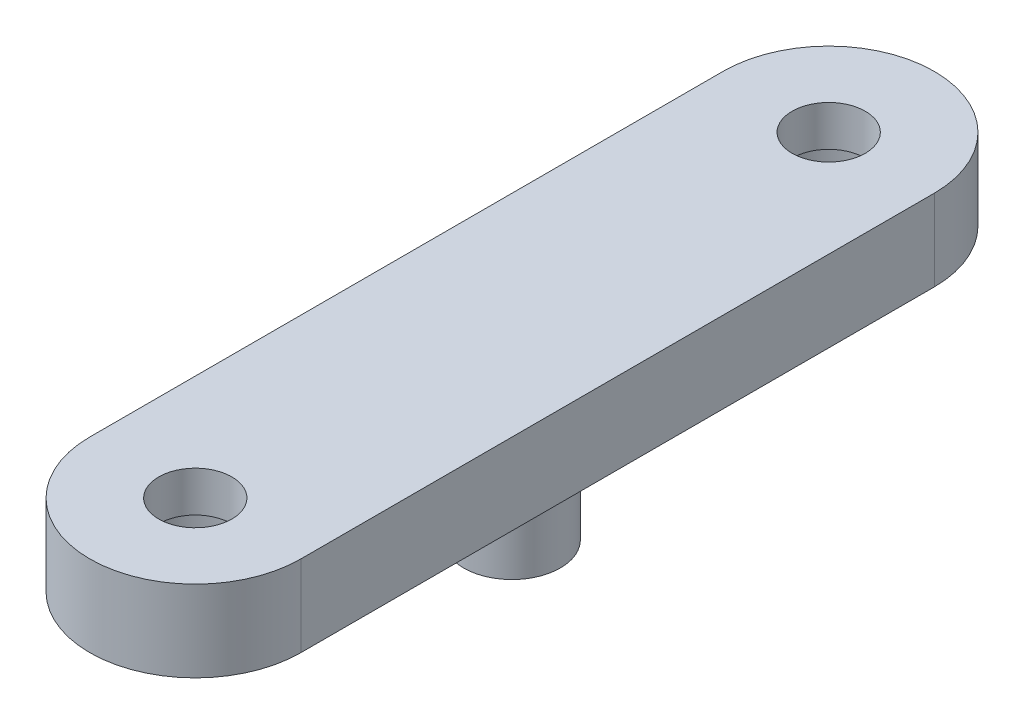
from build123d import *

# Parameters (mm, degrees)
BARRA_START         = -57.75
SK_BARRA_W          = 13
SK_BARRA_H          = 39
BARRA_DEPTH         = 5
EXTREMOS_START      = -57.75
SK_EXTREMOS_R       = 6.5
EXTREMOS_DEPTH      = 5
PERNO_696_START     = -64.75
SK_PERNO_696_R      = 2.975
PERNO_696_DEPTH     = 7
PASANTES_M4_START   = -57.75
SK_PASANTES_M4_R    = 2.25
PASANTES_M4_DEPTH   = 5
AVELLANADO_M4_START = -57.75
SK_AVELLANADO_M4_R  = 4.2
AVELLANADO_M4_DEPTH = 2.5


with BuildPart() as part:
    # Sk_Barra → Barra (new body)
    with BuildSketch(Plane(origin=(0, 0, 0), x_dir=(1, 0, 0), z_dir=(0, 1, 0)).offset(BARRA_START)):
        with Locations((0, -330)):
            Rectangle(SK_BARRA_W, SK_BARRA_H)
    extrude(amount=BARRA_DEPTH)

    # Sk_Extremos → Extremos (add)
    with BuildSketch(Plane(origin=(0, 0, 0), x_dir=(1, 0, 0), z_dir=(0, 1, 0)).offset(EXTREMOS_START)):
        with Locations((0, -310.5)):
            Circle(SK_EXTREMOS_R)
        with Locations((0, -349.5)):
            Circle(SK_EXTREMOS_R)
    extrude(amount=EXTREMOS_DEPTH)

    # Sk_Perno_696 → Perno_696 (add)
    with BuildSketch(Plane(origin=(0, 0, 0), x_dir=(1, 0, 0), z_dir=(0, 1, 0)).offset(PERNO_696_START)):
        with Locations(Location((0, -330, 0), (0, 0, 270))):
            Circle(SK_PERNO_696_R)
    extrude(amount=PERNO_696_DEPTH)

    # Sk_Pasantes_M4 → Pasantes_M4 (cut)
    with BuildSketch(Plane(origin=(0, 0, 0), x_dir=(1, 0, 0), z_dir=(0, 1, 0)).offset(PASANTES_M4_START)):
        with Locations(Location((0, -310.5, 0), (0, 0, 270))):
            Circle(SK_PASANTES_M4_R)
        with Locations(Location((0, -349.5, 0), (0, 0, 270))):
            Circle(SK_PASANTES_M4_R)
    extrude(amount=PASANTES_M4_DEPTH, mode=Mode.SUBTRACT)

    # Sk_Avellanado_M4 → Avellanado_M4 (cut)
    with BuildSketch(Plane(origin=(0, 0, 0), x_dir=(1, 0, 0), z_dir=(0, 1, 0)).offset(AVELLANADO_M4_START)):
        with Locations(Location((0, -310.5, 0), (0, 0, 270))):
            Circle(SK_AVELLANADO_M4_R)
        with Locations(Location((0, -349.5, 0), (0, 0, 270))):
            Circle(SK_AVELLANADO_M4_R)
    extrude(amount=AVELLANADO_M4_DEPTH, mode=Mode.SUBTRACT)


solid = part.part
